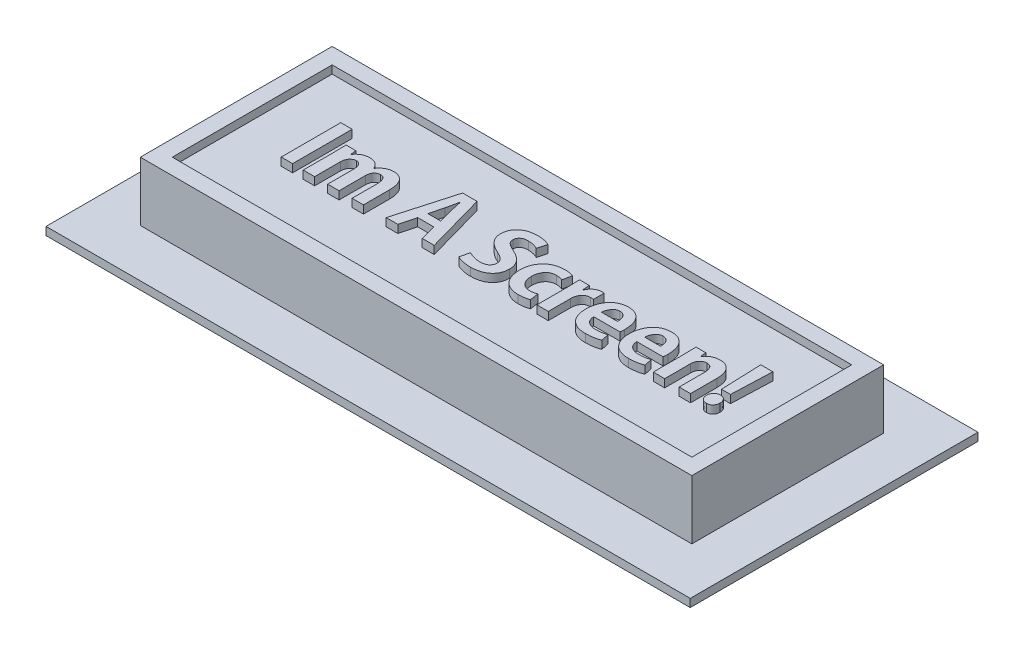
from build123d import *

# Parameters (mm, degrees)
SKETCH1_W           = 80.6
SKETCH1_H           = 36
BOSS_EXTRUDE1_DEPTH = 1
SKETCH2_W           = 69
SKETCH2_H           = 24
BOSS_EXTRUDE2_DEPTH = 7.4
SKETCH3_W           = 65
SKETCH3_H           = 20
CUT_EXTRUDE1_DEPTH  = 1
SKETCH4_W           = 1.427203244
SKETCH4_H           = 7.450666667
BOSS_EXTRUDE3_DEPTH = 1


with BuildPart() as part:
    # Sketch1 → Boss-Extrude1 (new body)
    with BuildSketch(Plane(origin=(0, 0, 0), x_dir=(1, 0, 0), z_dir=(0, 1, 0))):
        Rectangle(SKETCH1_W, SKETCH1_H)
    extrude(amount=-BOSS_EXTRUDE1_DEPTH)

    # Sketch2 → Boss-Extrude2 (add)
    with BuildSketch(Plane(origin=(0, 0, 0), x_dir=(1, 0, 0), z_dir=(0, 1, 0))):
        Rectangle(SKETCH2_W, SKETCH2_H)
    extrude(amount=BOSS_EXTRUDE2_DEPTH)

    # Sketch3 → Cut-Extrude1 (cut)
    with BuildSketch(Plane(origin=(0, 7.4, 0), x_dir=(1, 0, 0), z_dir=(0, 1, 0))):
        Rectangle(SKETCH3_W, SKETCH3_H)
    extrude(amount=-CUT_EXTRUDE1_DEPTH, mode=Mode.SUBTRACT)

    # Sketch4 → Boss-Extrude3 (add)
    # profile 1 of 11: a face of its own
    with BuildSketch(Plane(origin=(0, 6.4, 0), x_dir=(1, 0, 0), z_dir=(0, 1, 0))):
        with Locations((-24.986860891, 0.553226303)):
            Rectangle(SKETCH4_W, SKETCH4_H)
    # profile 2 of 11: a face of its own
    with BuildSketch(Plane(origin=(0, 6.4, 0), x_dir=(1, 0, 0), z_dir=(0, 1, 0))):
        with BuildLine():
            add(Edge.make_bspline(
                [(-18.68550928, 1.403628233), (-18.715742013, 1.470543978), (-18.775006998, 1.601718382), (-18.897423981, 1.778557798), (-19.042784468, 1.933158656), (-19.213006744, 2.062914701), (-19.403719743, 2.167387149), (-19.613330074, 2.243758188), (-19.841314104, 2.289041839), (-19.998939378, 2.295813045), (-20.080151408, 2.299301719)],
                knots=[0, 0, 0, 0, 0.997036998, 1.954483718, 2.909576397, 3.872577742, 4.853047321, 5.856395523, 6.895567533, 8, 8, 8, 8], degree=3))
            add(Edge.make_bspline(
                [(-20.080151408, 2.299301719), (-20.175931654, 2.294220507), (-20.359102622, 2.284503153), (-20.619315498, 2.232315153), (-20.851603177, 2.150182601), (-21.053254632, 2.035706175), (-21.227203121, 1.904301797), (-21.380552701, 1.767668543), (-21.511801742, 1.625084752), (-21.581599353, 1.52106243), (-21.615517201, 1.470513231)],
                knots=[0, 0, 0, 0, 1.262432143, 2.414286113, 3.483755676, 4.494660452, 5.455867319, 6.351457605, 7.198897928, 8, 8, 8, 8], degree=3))
            Line((-21.615517201, 1.470513231), (-21.643765368, 1.47114426))
            Line((-21.643765368, 1.47114426), (-21.712664173, 2.18488512))
            Line((-21.712664173, 2.18488512), (-22.952324115, 2.18488512))
            add(Edge.make_bspline(
                [(-22.952324115, 2.18488512), (-22.947032632, 2.064769798), (-22.936050982, 1.815489142), (-22.925072024, 1.426551849), (-22.91841677, 1.008377938), (-22.916091259, 0.719455033), (-22.914888984, 0.570083704)],
                knots=[0, 0, 0, 0, 0.893157475, 1.853609332, 2.890329491, 4, 4, 4, 4], degree=3))
            Line((-22.914888984, 0.570083704), (-22.913485629, -3.206701158))
            Line((-22.913485629, -3.206701158), (-21.486282386, -3.206701158))
            Line((-21.486282386, -3.206701158), (-21.486282386, 0.046022042))
            add(Edge.make_bspline(
                [(-21.486282386, 0.046022042), (-21.484049537, 0.089652467), (-21.479693459, 0.174771326), (-21.463671336, 0.298581361), (-21.442811317, 0.415193188), (-21.409531418, 0.522429336), (-21.370442911, 0.621275502), (-21.324123876, 0.712075144), (-21.269163279, 0.794355379), (-21.186034128, 0.888788848), (-21.075249184, 0.988412983), (-20.931056727, 1.07609466), (-20.780021693, 1.132559175), (-20.675755076, 1.138730846), (-20.623780468, 1.141807288)],
                knots=[0, 0, 0, 0, 1.015991475, 1.982103866, 2.902933749, 3.767943163, 4.589249783, 5.373677027, 6.135072995, 6.884212924, 8.29641728, 9.581790074, 10.794575681, 12, 12, 12, 12], degree=3))
            add(Edge.make_bspline(
                [(-20.623780468, 1.141807288), (-20.589948751, 1.1404445), (-20.524584699, 1.137811546), (-20.431203097, 1.117995349), (-20.344370253, 1.092861204), (-20.266829484, 1.053443895), (-20.194788562, 1.007328009), (-20.132224744, 0.948664177), (-20.074339108, 0.882407347), (-20.011753165, 0.776883203), (-19.946454781, 0.629680716), (-19.891976261, 0.433849413), (-19.861354227, 0.217077775), (-19.859283466, 0.065887809), (-19.85820466, -0.012877691)],
                knots=[0, 0, 0, 0, 0.778438463, 1.503970174, 2.193072329, 2.853909163, 3.500059889, 4.156658281, 4.822318485, 5.519726913, 6.972953294, 8.519672451, 10.186852288, 12, 12, 12, 12], degree=3))
            Line((-19.85820466, -0.012877691), (-19.856801306, -3.206701158))
            Line((-19.856801306, -3.206701158), (-18.429599434, -3.206701158))
            Line((-18.429599434, -3.206701158), (-18.429599434, 0.075150906))
            add(Edge.make_bspline(
                [(-18.429599434, 0.075150906), (-18.42795186, 0.120310165), (-18.424755671, 0.207916246), (-18.408739731, 0.334247711), (-18.386860991, 0.451847584), (-18.356322262, 0.559586044), (-18.317754996, 0.657645358), (-18.273920404, 0.746802496), (-18.219273905, 0.82479038), (-18.140467306, 0.914631663), (-18.031174132, 1.005588094), (-17.890586097, 1.087094354), (-17.740515448, 1.134332697), (-17.638114379, 1.139310847), (-17.586762312, 1.141807288)],
                knots=[0, 0, 0, 0, 1.068514525, 2.072850033, 3.009155609, 3.896203593, 4.716938048, 5.499641549, 6.240135765, 6.9622584, 8.322368171, 9.582260067, 10.787552263, 12, 12, 12, 12], degree=3))
            add(Edge.make_bspline(
                [(-17.586762312, 1.141807288), (-17.552493364, 1.140344616), (-17.485800513, 1.137498023), (-17.390042514, 1.11879991), (-17.301924417, 1.090440508), (-17.220324194, 1.053181744), (-17.148488733, 1.001154273), (-17.083367757, 0.940285247), (-17.024772886, 0.869534619), (-16.958859065, 0.756877998), (-16.890871191, 0.594404651), (-16.836268015, 0.373234693), (-16.80397803, 0.122003873), (-16.80237015, -0.055382216), (-16.801520337, -0.149136137)],
                knots=[0, 0, 0, 0, 0.723474212, 1.407996489, 2.052123571, 2.675738152, 3.292971063, 3.915565833, 4.554894172, 5.224690713, 6.664493501, 8.256831909, 10.021622282, 12, 12, 12, 12], degree=3))
            Line((-16.801520337, -0.149136137), (-16.800118354, -3.206701158))
            Line((-16.800118354, -3.206701158), (-15.372916483, -3.206701158))
            Line((-15.372916483, -3.206701158), (-15.372916483, 0.075150906))
            add(Edge.make_bspline(
                [(-15.372916483, 0.075150906), (-15.37616057, 0.168539998), (-15.382442786, 0.349389176), (-15.407379017, 0.610941515), (-15.446382022, 0.85315017), (-15.498603907, 1.076371239), (-15.568455007, 1.279333662), (-15.648284358, 1.46474208), (-15.746110714, 1.629066646), (-15.857679834, 1.773294441), (-15.980692825, 1.89798056), (-16.110517336, 2.00808759), (-16.250141919, 2.099138002), (-16.396991491, 2.174230801), (-16.551920794, 2.232561036), (-16.714960255, 2.273196961), (-16.886569928, 2.295643875), (-17.003268571, 2.298066088), (-17.06279942, 2.299301719)],
                knots=[0, 0, 0, 0, 1.420634134, 2.75107627, 3.991776804, 5.148758875, 6.231718827, 7.251719496, 8.212661777, 9.131207487, 10.017311253, 10.871462022, 11.714652689, 12.545702641, 13.374829041, 14.22612649, 15.095103491, 16, 16, 16, 16], degree=3))
            add(Edge.make_bspline(
                [(-17.06279942, 2.299301719), (-17.137426994, 2.298096698), (-17.285828755, 2.295700436), (-17.504522393, 2.255363111), (-17.718068185, 2.192257272), (-17.9253863, 2.09999594), (-18.127599974, 1.979001313), (-18.317916634, 1.819343122), (-18.502036132, 1.627690645), (-18.610615438, 1.479853124), (-18.666996799, 1.403086371)],
                knots=[0, 0, 0, 0, 0.932112966, 1.85356694, 2.770748812, 3.712089394, 4.684367622, 5.707962557, 6.809826692, 8, 8, 8, 8], degree=3))
            Line((-18.666996799, 1.403086371), (-18.68550928, 1.403628233))
        make_face()
    # profile 3 of 11: a face of its own
    with BuildSketch(Plane(origin=(0, 6.4, 0), x_dir=(1, 0, 0), z_dir=(0, 1, 0))):
        Polygon((-10.457016606, 4.278559636), (-12.573714091, -3.165307003), (-11.117270867, -3.165307003), (-10.602660928, -1.19425384), (-8.602478901, -1.19425384), (-8.068449719, -3.165307003), (-6.563458387, -3.165307003), (-8.651027008, 4.278559636), align=None)
        with BuildLine():
            add(Edge.make_bspline(
                [(-9.952116288, 1.595029044), (-9.924104669, 1.714046874), (-9.865351426, 1.963681978), (-9.782867332, 2.347764191), (-9.700448682, 2.736779984), (-9.648451785, 2.995067485), (-9.623369191, 3.11966185)],
                knots=[0, 0, 0, 0, 0.94066455, 1.973005993, 3.022205752, 4, 4, 4, 4], degree=3))
            Line((-9.623369191, 3.11966185), (-9.592860293, 3.121063833))
            add(Edge.make_bspline(
                [(-9.592860293, 3.121063833), (-9.566949881, 2.998390657), (-9.513046305, 2.743183493), (-9.431589446, 2.355045141), (-9.345293022, 1.965251047), (-9.283778659, 1.708766255), (-9.253926187, 1.584296057)],
                knots=[0, 0, 0, 0, 0.95601635, 1.988879968, 3.024018124, 4, 4, 4, 4], degree=3))
            Line((-9.253926187, 1.584296057), (-8.806380952, -0.126660517))
            Line((-8.806380952, -0.126660517), (-10.398758877, -0.126660517))
            Line((-10.398758877, -0.126660517), (-9.952116288, 1.595029044))
        make_face(mode=Mode.SUBTRACT)
    # profile 4 of 11: a face of its own
    with BuildSketch(Plane(origin=(0, 6.4, 0), x_dir=(1, 0, 0), z_dir=(0, 1, 0))):
        with BuildLine():
            add(Edge.make_bspline(
                [(-3.771451103, -2.860599382), (-3.722282859, -2.887805448), (-3.617362523, -2.945860595), (-3.438395032, -3.014616115), (-3.234557906, -3.083112804), (-3.005110188, -3.14115868), (-2.758911347, -3.1933582), (-2.500402688, -3.230936526), (-2.233560003, -3.25534473), (-2.052415796, -3.25976747), (-1.960587489, -3.262009511)],
                knots=[0, 0, 0, 0, 0.719594672, 1.535546325, 2.452393094, 3.475924305, 4.567249392, 5.677640584, 6.822715122, 8, 8, 8, 8], degree=3))
            add(Edge.make_bspline(
                [(-1.960587489, -3.262009511), (-1.85606796, -3.259382285), (-1.652613935, -3.25426822), (-1.357601219, -3.22050358), (-1.08050369, -3.173108465), (-0.822979042, -3.103293938), (-0.582641462, -3.019033348), (-0.362198874, -2.912698596), (-0.160030514, -2.788773028), (0.023065302, -2.647191351), (0.184096198, -2.488604639), (0.328200766, -2.320775478), (0.445680532, -2.13706451), (0.54598066, -1.944132128), (0.620854192, -1.73686708), (0.678375082, -1.518562006), (0.709775646, -1.28692276), (0.715372252, -1.128782748), (0.718225473, -1.048160938)],
                knots=[0, 0, 0, 0, 1.280827998, 2.493214574, 3.635842522, 4.723067123, 5.759595453, 6.75296466, 7.716578851, 8.661346905, 9.582605015, 10.482742654, 11.366187061, 12.249109382, 13.142470757, 14.061151216, 15.011549973, 16, 16, 16, 16], degree=3))
            add(Edge.make_bspline(
                [(0.718225473, -1.048160938), (0.717222288, -0.987721786), (0.715242252, -0.868429981), (0.697271514, -0.692541046), (0.663793263, -0.523434425), (0.621679095, -0.359051699), (0.561383798, -0.202469756), (0.491522024, -0.050460138), (0.406341386, 0.09418435), (0.309310931, 0.234202409), (0.197225206, 0.367952769), (0.071685862, 0.49780227), (-0.068787155, 0.622622725), (-0.224696871, 0.741719995), (-0.39295259, 0.85909217), (-0.577348695, 0.969429047), (-0.776191881, 1.074785072), (-0.914738592, 1.140469789), (-0.98570747, 1.174115992)],
                knots=[0, 0, 0, 0, 0.971604692, 1.917705205, 2.837533086, 3.741450306, 4.641944002, 5.53106885, 6.428441787, 7.336893241, 8.26704506, 9.230684205, 10.238479509, 11.285007773, 12.38342881, 13.535071349, 14.737370079, 16, 16, 16, 16], degree=3))
            add(Edge.make_bspline(
                [(-0.98570747, 1.174115992), (-1.039655802, 1.198716631), (-1.144289354, 1.246429918), (-1.294346712, 1.319143639), (-1.432446146, 1.390983512), (-1.558912636, 1.461239334), (-1.674823156, 1.529569182), (-1.778008079, 1.598794461), (-1.871317323, 1.663997439), (-1.952657836, 1.729511213), (-2.024201862, 1.795659902), (-2.085078725, 1.866284437), (-2.13623445, 1.941800965), (-2.178186141, 2.020765946), (-2.209709373, 2.104463415), (-2.231657424, 2.191644152), (-2.247000911, 2.283313189), (-2.247100836, 2.346061286), (-2.247151644, 2.377966389)],
                knots=[0, 0, 0, 0, 1.534293153, 2.975783242, 4.314400128, 5.561899513, 6.719353789, 7.794748337, 8.776507069, 9.664015056, 10.495494951, 11.294559956, 12.0708857, 12.851360931, 13.602992373, 14.37884518, 15.175702311, 16, 16, 16, 16], degree=3))
            add(Edge.make_bspline(
                [(-2.247151644, 2.377966389), (-2.244371727, 2.431248051), (-2.238866121, 2.536771979), (-2.188419226, 2.689562009), (-2.104924038, 2.830983165), (-2.009119935, 2.936244723), (-1.917253666, 3.012590038), (-1.836539195, 3.062582467), (-1.747577757, 3.107083825), (-1.648371721, 3.140822079), (-1.541343222, 3.171348678), (-1.424607179, 3.191782322), (-1.298722162, 3.20391375), (-1.211893355, 3.207636167), (-1.166917157, 3.20956433)],
                knots=[0, 0, 0, 0, 1.252807395, 2.481175558, 3.747276352, 5.098962457, 5.812468956, 6.556386487, 7.331171674, 8.151379655, 9.021437812, 9.952148669, 10.939239512, 12, 12, 12, 12], degree=3))
            add(Edge.make_bspline(
                [(-1.166917157, 3.20956433), (-1.093823556, 3.207144693), (-0.952496488, 3.202466305), (-0.748227309, 3.181716202), (-0.559480084, 3.148240069), (-0.386560039, 3.103216199), (-0.230582222, 3.050256344), (-0.089860627, 2.999407682), (0.033657585, 2.946096116), (0.108327146, 2.906592077), (0.143692436, 2.887882019)],
                knots=[0, 0, 0, 0, 1.287765497, 2.48990501, 3.61253477, 4.660633034, 5.633348447, 6.512647364, 7.29555421, 8, 8, 8, 8], degree=3))
            Line((0.143692436, 2.887882019), (0.441868904, 4.039096336))
            add(Edge.make_bspline(
                [(0.441868904, 4.039096336), (0.395556959, 4.060287288), (0.298959299, 4.104487468), (0.143679291, 4.16640754), (-0.030709131, 4.216994863), (-0.220014908, 4.26948047), (-0.427018144, 4.31065447), (-0.650008684, 4.343863331), (-0.889472918, 4.360714232), (-1.054051658, 4.364901823), (-1.138822632, 4.367058762)],
                knots=[0, 0, 0, 0, 0.751083297, 1.566612858, 2.462144976, 3.426904781, 4.462872615, 5.572206229, 6.749495582, 8, 8, 8, 8], degree=3))
            add(Edge.make_bspline(
                [(-1.138822632, 4.367058762), (-1.23629599, 4.363645993), (-1.426089405, 4.357000884), (-1.701782775, 4.326225596), (-1.960688831, 4.277314782), (-2.20262009, 4.20986657), (-2.428826865, 4.126025665), (-2.637920631, 4.023118581), (-2.830354009, 3.901977937), (-3.004171215, 3.762448368), (-3.160473433, 3.609892738), (-3.295660074, 3.444378135), (-3.412274493, 3.269519322), (-3.506941852, 3.08277457), (-3.579812921, 2.885004241), (-3.633167352, 2.677003069), (-3.668040913, 2.458247917), (-3.67315173, 2.308331878), (-3.675758242, 2.231874859)],
                knots=[0, 0, 0, 0, 1.256955866, 2.447457956, 3.572082846, 4.649959342, 5.681406033, 6.67750641, 7.648772353, 8.6065338, 9.545567091, 10.459092244, 11.356420819, 12.24994494, 13.151405518, 14.067877277, 15.01461949, 16, 16, 16, 16], degree=3))
            add(Edge.make_bspline(
                [(-3.675758242, 2.231874859), (-3.673522001, 2.171857755), (-3.6691024, 2.053242783), (-3.644408676, 1.878470584), (-3.607179779, 1.70941945), (-3.553397528, 1.546600513), (-3.48360207, 1.390828755), (-3.40273037, 1.239385243), (-3.304658205, 1.095397424), (-3.191810854, 0.95814642), (-3.067007782, 0.826661192), (-2.930790557, 0.70063482), (-2.783533162, 0.580004846), (-2.623895631, 0.46516043), (-2.454363397, 0.353105007), (-2.270893081, 0.250818214), (-2.078379042, 0.149399324), (-1.943629211, 0.089377743), (-1.874899187, 0.058763348)],
                knots=[0, 0, 0, 0, 0.960729928, 1.898741275, 2.820565259, 3.728266954, 4.637606962, 5.549753057, 6.472673147, 7.420779733, 8.390934511, 9.372027768, 10.389211705, 11.435574366, 12.518575566, 13.639649148, 14.796087777, 16, 16, 16, 16], degree=3))
            add(Edge.make_bspline(
                [(-1.874899187, 0.058763348), (-1.779632101, 0.015661072), (-1.60029954, -0.065475464), (-1.356887305, -0.201007172), (-1.152683584, -0.336895389), (-0.988662531, -0.479305943), (-0.858952119, -0.628966487), (-0.771383209, -0.795337274), (-0.715754283, -0.975315563), (-0.711269775, -1.100654765), (-0.708976399, -1.164753217)],
                knots=[0, 0, 0, 0, 1.393665495, 2.6234622, 3.710952145, 4.657720235, 5.513058752, 6.334242817, 7.148131986, 8, 8, 8, 8], degree=3))
            add(Edge.make_bspline(
                [(-0.708976399, -1.164753217), (-0.709636842, -1.199454727), (-0.710927855, -1.267288038), (-0.725375188, -1.366185425), (-0.748942046, -1.459629757), (-0.783540964, -1.547264923), (-0.825223607, -1.630774251), (-0.877787187, -1.708514362), (-0.94008988, -1.780567165), (-1.011777267, -1.846470324), (-1.092395917, -1.905675814), (-1.181754822, -1.95806395), (-1.280082102, -2.002848995), (-1.387396644, -2.039372178), (-1.503664946, -2.067047737), (-1.628442726, -2.088218445), (-1.762753761, -2.10054525), (-1.855208925, -2.103162416), (-1.902993713, -2.10451508)],
                knots=[0, 0, 0, 0, 0.969766496, 1.895666023, 2.788091005, 3.658633537, 4.525326931, 5.393305268, 6.275294433, 7.18343149, 8.110533905, 9.067217099, 10.075045017, 11.126827756, 12.232027601, 13.413846859, 14.663365337, 16, 16, 16, 16], degree=3))
            add(Edge.make_bspline(
                [(-1.902993713, -2.10451508), (-1.977958462, -2.102092257), (-2.126792711, -2.09728201), (-2.347999356, -2.075026536), (-2.564708483, -2.036691025), (-2.775287138, -1.985110449), (-2.975697763, -1.922083227), (-3.163280602, -1.852373414), (-3.335352836, -1.77427228), (-3.441575771, -1.713839997), (-3.493143829, -1.68450193)],
                knots=[0, 0, 0, 0, 1.082450425, 2.149086012, 3.20582521, 4.256603573, 5.276294291, 6.236645749, 7.143944243, 8, 8, 8, 8], degree=3))
            Line((-3.493143829, -1.68450193), (-3.771451103, -2.860599382))
        make_face()
    # profile 5 of 11: a face of its own
    with BuildSketch(Plane(origin=(0, 6.4, 0), x_dir=(1, 0, 0), z_dir=(0, 1, 0))):
        with BuildLine():
            add(Edge.make_bspline(
                [(5.382372067, 2.175683065), (5.350009647, 2.188124912), (5.280879448, 2.21470226), (5.168902518, 2.251132225), (5.042007624, 2.284046219), (4.850808852, 2.328746089), (4.587046542, 2.370044636), (4.368826539, 2.377104087), (4.255326174, 2.380775842)],
                knots=[0, 0, 0, 0, 0.541847231, 1.15745385, 1.839115937, 2.590051948, 4.226421316, 6, 6, 6, 6], degree=3))
            add(Edge.make_bspline(
                [(4.255326174, 2.380775842), (4.146541026, 2.376635202), (3.93420519, 2.36855316), (3.626311622, 2.324208954), (3.337500424, 2.257047553), (3.067392446, 2.16589883), (2.816483792, 2.049474336), (2.58559993, 1.907384776), (2.37284885, 1.74273018), (2.183136715, 1.55179467), (2.011372101, 1.345026212), (1.864134786, 1.12122483), (1.735983875, 0.886162339), (1.633725944, 0.635088023), (1.552253265, 0.370952111), (1.493151703, 0.093190692), (1.457947043, -0.198349317), (1.451817846, -0.397208339), (1.448683124, -0.498912974)],
                knots=[0, 0, 0, 0, 1.154617847, 2.253678444, 3.29503799, 4.29757116, 5.27348448, 6.223708663, 7.168982913, 8.121179864, 9.074245094, 10.016903677, 10.959562261, 11.910942048, 12.888561654, 13.88945568, 14.920581334, 16, 16, 16, 16], degree=3))
            add(Edge.make_bspline(
                [(1.448683124, -0.498912974), (1.451770124, -0.604367678), (1.457796644, -0.810238985), (1.493267726, -1.109475691), (1.548916261, -1.390612173), (1.626332139, -1.653542979), (1.724504228, -1.898929253), (1.843829604, -2.126370911), (1.985828536, -2.334642256), (2.147486665, -2.524292374), (2.326790091, -2.69465822), (2.524314637, -2.841936337), (2.736831789, -2.966976941), (2.965025917, -3.070682603), (3.209790544, -3.150144426), (3.469656027, -3.209334701), (3.745883842, -3.244368369), (3.934949788, -3.250456728), (4.0319747, -3.253581153)],
                knots=[0, 0, 0, 0, 1.185825819, 2.314998766, 3.383718313, 4.404951788, 5.392442684, 6.351016225, 7.287101152, 8.220828758, 9.148225935, 10.062254741, 10.985112179, 11.915866123, 12.874902268, 13.873739595, 14.908845112, 16, 16, 16, 16], degree=3))
            add(Edge.make_bspline(
                [(4.0319747, -3.253581153), (4.102703071, -3.252348265), (4.240552643, -3.249945367), (4.441195663, -3.235803151), (4.630623893, -3.213503539), (4.807305724, -3.182939261), (4.968214113, -3.146373849), (5.111650076, -3.109164613), (5.234779447, -3.068010957), (5.308600918, -3.035406094), (5.342584293, -3.020396596)],
                knots=[0, 0, 0, 0, 1.266754215, 2.468903584, 3.600631184, 4.681535172, 5.678465714, 6.555210452, 7.334897762, 8, 8, 8, 8], degree=3))
            Line((5.342584293, -3.020396596), (5.188179637, -1.937923326))
            add(Edge.make_bspline(
                [(5.188179637, -1.937923326), (5.127888133, -1.964319845), (5.001938823, -2.019462329), (4.792095161, -2.069512161), (4.560345681, -2.104136082), (4.397819537, -2.109921355), (4.312919951, -2.112943437)],
                knots=[0, 0, 0, 0, 0.87676423, 1.831565681, 2.867264228, 4, 4, 4, 4], degree=3))
            add(Edge.make_bspline(
                [(4.312919951, -2.112943437), (4.261329189, -2.111125325), (4.160530126, -2.107573062), (4.013444901, -2.085613406), (3.872959089, -2.053123922), (3.741165611, -2.002363267), (3.614219686, -1.942758374), (3.496559975, -1.866142801), (3.386312861, -1.776800508), (3.283499353, -1.675797275), (3.190238908, -1.561610547), (3.109601952, -1.434682081), (3.037682566, -1.297827624), (2.982706972, -1.147630005), (2.937633264, -0.986997837), (2.904037291, -0.815129837), (2.882724501, -0.631946078), (2.879133655, -0.50599583), (2.877289722, -0.441319198)],
                knots=[0, 0, 0, 0, 0.998859532, 1.951591722, 2.875231318, 3.78469887, 4.680917394, 5.586353418, 6.495459316, 7.425131778, 8.372498858, 9.343309935, 10.332783696, 11.360046324, 12.433641722, 13.561024455, 14.747563201, 16, 16, 16, 16], degree=3))
            add(Edge.make_bspline(
                [(2.877289722, -0.441319198), (2.878771355, -0.381801375), (2.881671647, -0.265295407), (2.900509311, -0.094451195), (2.929270014, 0.068180052), (2.970628417, 0.222591773), (3.021813744, 0.369361237), (3.087386371, 0.506817149), (3.161436113, 0.637568908), (3.248716182, 0.757550268), (3.345061522, 0.86832166), (3.453910362, 0.96365143), (3.572028625, 1.046238175), (3.699221975, 1.115586887), (3.837796795, 1.166998003), (3.984388206, 1.206665986), (4.141173519, 1.2322422), (4.249144233, 1.237462251), (4.304491593, 1.240138126)],
                knots=[0, 0, 0, 0, 1.152800695, 2.256604074, 3.325842897, 4.34888118, 5.35009528, 6.332019554, 7.295036531, 8.256642933, 9.201201668, 10.132957584, 11.051374066, 11.988807583, 12.930444073, 13.907328497, 14.927266108, 16, 16, 16, 16], degree=3))
            add(Edge.make_bspline(
                [(4.304491593, 1.240138126), (4.35133733, 1.238153054), (4.441855939, 1.23431736), (4.572590215, 1.222985957), (4.693120354, 1.207995072), (4.803721458, 1.188088595), (4.904349021, 1.165012321), (4.995210086, 1.136318574), (5.076759863, 1.105414633), (5.125568569, 1.078652683), (5.14873207, 1.06595207)],
                knots=[0, 0, 0, 0, 1.29360923, 2.499602188, 3.619770261, 4.643630639, 5.599445193, 6.465756666, 7.271883015, 8, 8, 8, 8], degree=3))
            Line((5.14873207, 1.06595207), (5.382372067, 2.175683065))
        make_face()
    # profile 6 of 11: a face of its own
    with BuildSketch(Plane(origin=(0, 6.4, 0), x_dir=(1, 0, 0), z_dir=(0, 1, 0))):
        with BuildLine():
            Line((7.548791923, 1.266912976), (7.490929273, 2.186923619))
            Line((7.490929273, 2.186923619), (6.265981918, 2.186923619))
            add(Edge.make_bspline(
                [(6.265981918, 2.186923619), (6.270642549, 2.064716978), (6.280302257, 1.811429272), (6.290267381, 1.488791784), (6.298734602, 1.214889362), (6.300254262, 0.995242611), (6.304273641, 0.763947673), (6.303707612, 0.606140392), (6.303417049, 0.525132463)],
                knots=[0, 0, 0, 0, 1.324207679, 2.744576904, 3.495229973, 4.291304775, 5.122867722, 6, 6, 6, 6], degree=3))
            Line((6.303417049, 0.525132463), (6.304820404, -3.192313689))
            Line((6.304820404, -3.192313689), (7.732023647, -3.192313689))
            Line((7.732023647, -3.192313689), (7.732023647, -0.395942699))
            add(Edge.make_bspline(
                [(7.732023647, -0.395942699), (7.733601296, -0.340319586), (7.736661567, -0.232423676), (7.753649227, -0.076213105), (7.780018377, 0.068960217), (7.816096063, 0.203181269), (7.863316247, 0.325878994), (7.916576698, 0.439461022), (7.984323838, 0.539453848), (8.058251805, 0.630266705), (8.141513952, 0.708092098), (8.229476518, 0.77706132), (8.323790405, 0.833939598), (8.422884349, 0.882994675), (8.528706079, 0.919318276), (8.639981656, 0.943911646), (8.756506056, 0.960506437), (8.836077949, 0.961495316), (8.876875542, 0.962002328)],
                knots=[0, 0, 0, 0, 1.328993375, 2.577938255, 3.749595128, 4.851401761, 5.892294362, 6.887899519, 7.84040204, 8.769965346, 9.679936652, 10.557066843, 11.435764995, 12.306307666, 13.19428498, 14.100673707, 15.026189549, 16, 16, 16, 16], degree=3))
            add(Edge.make_bspline(
                [(8.876875542, 0.962002328), (8.94349083, 0.961233649), (9.067268928, 0.959805364), (9.189753232, 0.942089354), (9.246318546, 0.933907803)],
                knots=[0, 0, 0, 0, 1.076366321, 2, 2, 2, 2], degree=3))
            Line((9.246318546, 0.933907803), (9.2467246, 2.272285431))
            add(Edge.make_bspline(
                [(9.2467246, 2.272285431), (9.198005174, 2.280690514), (9.091936576, 2.298989486), (8.984259698, 2.299192145), (8.926040961, 2.299301719)],
                knots=[0, 0, 0, 0, 0.918639949, 2, 2, 2, 2], degree=3))
            add(Edge.make_bspline(
                [(8.926040961, 2.299301719), (8.860688979, 2.295788158), (8.72921732, 2.288719763), (8.533846855, 2.239007728), (8.342579029, 2.155198449), (8.154992817, 2.042402247), (7.978756961, 1.8968055), (7.824617664, 1.715773059), (7.689348792, 1.505476471), (7.622057096, 1.348053094), (7.587336843, 1.266827924)],
                knots=[0, 0, 0, 0, 0.873024494, 1.756304479, 2.675727742, 3.655517484, 4.673026258, 5.715548879, 6.821300036, 8, 8, 8, 8], degree=3))
            Line((7.587336843, 1.266827924), (7.548791923, 1.266912976))
        make_face()
    # profile 7 of 11: a face of its own
    with BuildSketch(Plane(origin=(0, 6.4, 0), x_dir=(1, 0, 0), z_dir=(0, 1, 0))):
        with BuildLine():
            add(Edge.make_bspline(
                [(14.432329174, -0.9245464), (14.438405913, -0.883856406), (14.451152409, -0.798505562), (14.46328694, -0.663945946), (14.47037544, -0.518190747), (14.470454619, -0.417447558), (14.470495476, -0.36546398)],
                knots=[0, 0, 0, 0, 0.879814102, 1.845487553, 2.888269607, 4, 4, 4, 4], degree=3))
            add(Edge.make_bspline(
                [(14.470495476, -0.36546398), (14.46816519, -0.259099072), (14.463639096, -0.052507535), (14.43368868, 0.247401503), (14.386966814, 0.527459517), (14.320639362, 0.78714654), (14.238312252, 1.027370762), (14.137502587, 1.247701079), (14.01717753, 1.447017895), (13.88095764, 1.626453165), (13.727871326, 1.784335801), (13.562227313, 1.923621831), (13.380604308, 2.038018053), (13.18830861, 2.136131381), (12.980283994, 2.207541266), (12.760028076, 2.262056261), (12.52578633, 2.292361255), (12.365359878, 2.29695369), (12.283336702, 2.299301719)],
                knots=[0, 0, 0, 0, 1.306657607, 2.537908493, 3.699270234, 4.791739878, 5.826909547, 6.815290999, 7.762398175, 8.68170366, 9.57675071, 10.459137333, 11.333612719, 12.208315133, 13.105301175, 14.028952094, 14.992238463, 16, 16, 16, 16], degree=3))
            add(Edge.make_bspline(
                [(12.283336702, 2.299301719), (12.185772237, 2.29410807), (11.995757772, 2.283993031), (11.719829421, 2.238603111), (11.461854746, 2.168482689), (11.220903831, 2.074590985), (10.999089583, 1.954158342), (10.794702817, 1.810121209), (10.609789212, 1.639710998), (10.4434884, 1.446945245), (10.294913625, 1.237003622), (10.167584924, 1.012166979), (10.05641265, 0.777163191), (9.969054776, 0.52858699), (9.898100021, 0.269601557), (9.84811663, -0.001053005), (9.816325184, -0.283237593), (9.811879607, -0.475414327), (9.809613773, -0.573363465)],
                knots=[0, 0, 0, 0, 1.102218766, 2.14665769, 3.149339139, 4.115122672, 5.058741015, 5.991431174, 6.93040496, 7.889527187, 8.860316271, 9.828598601, 10.80279168, 11.790822775, 12.798603709, 13.831085196, 14.894541863, 16, 16, 16, 16], degree=3))
            add(Edge.make_bspline(
                [(9.809613773, -0.573363465), (9.81155863, -0.675086298), (9.81534319, -0.873032118), (9.850874263, -1.161221784), (9.902734815, -1.433209511), (9.977924873, -1.688249056), (10.070791448, -1.927526677), (10.189331123, -2.147705006), (10.325428521, -2.352927719), (10.483240445, -2.540040383), (10.660484649, -2.708540877), (10.859022197, -2.853398886), (11.074921123, -2.977984211), (11.310425727, -3.079092425), (11.56401175, -3.159331505), (11.837036174, -3.215894821), (12.128268967, -3.253384828), (12.329103886, -3.259083235), (12.432237685, -3.262009511)],
                knots=[0, 0, 0, 0, 1.145056205, 2.228202694, 3.265464393, 4.259985655, 5.218630789, 6.1504322, 7.070355583, 7.987236137, 8.901139799, 9.817656355, 10.748382851, 11.702521477, 12.69814653, 13.738580065, 14.838703788, 16, 16, 16, 16], degree=3))
            add(Edge.make_bspline(
                [(12.432237685, -3.262009511), (12.517482792, -3.26087153), (12.685303635, -3.258631203), (12.933209513, -3.242670138), (13.172783083, -3.217985878), (13.40279919, -3.182538083), (13.622072296, -3.139999799), (13.827197404, -3.086457603), (14.019038555, -3.026744937), (14.139271375, -2.978117995), (14.197978583, -2.954374462)],
                knots=[0, 0, 0, 0, 1.134244074, 2.232970358, 3.304290349, 4.337913843, 5.328893587, 6.274899807, 7.157669119, 8, 8, 8, 8], degree=3))
            Line((14.197978583, -2.954374462), (13.995396206, -1.974819339))
            add(Edge.make_bspline(
                [(13.995396206, -1.974819339), (13.901499413, -2.007055262), (13.70569648, -2.074276815), (13.386629168, -2.136427738), (13.036079752, -2.181235002), (12.790603471, -2.189899772), (12.66261279, -2.19441756)],
                knots=[0, 0, 0, 0, 0.87704573, 1.828902987, 2.867995791, 4, 4, 4, 4], degree=3))
            add(Edge.make_bspline(
                [(12.66261279, -2.19441756), (12.612483533, -2.194193405), (12.513456948, -2.193750606), (12.367927612, -2.180802743), (12.22833791, -2.158843848), (12.095358724, -2.125504337), (11.966869211, -2.085875698), (11.845186794, -2.033294387), (11.72892387, -1.972679857), (11.619083961, -1.902756885), (11.517517845, -1.821981499), (11.428531856, -1.727872409), (11.349961778, -1.62338832), (11.286404065, -1.505792066), (11.231366319, -1.377905472), (11.192454385, -1.237353669), (11.161570708, -1.085812828), (11.152833299, -0.980417188), (11.148317891, -0.925949754)],
                knots=[0, 0, 0, 0, 1.08234867, 2.138098532, 3.15234098, 4.131067708, 5.097013137, 6.053166887, 6.989593978, 7.926621641, 8.861682363, 9.784465562, 10.716952089, 11.676682853, 12.664718862, 13.717752465, 14.820556852, 16, 16, 16, 16], degree=3))
            Line((11.148317891, -0.925949754), (14.432329174, -0.9245464))
        make_face()
        with BuildLine():
            add(Edge.make_bspline(
                [(11.148317891, 0.053144443), (11.155442495, 0.125052301), (11.169762536, 0.269582937), (11.223855714, 0.483104371), (11.309193221, 0.690878461), (11.398157996, 0.859167517), (11.4837805, 0.986264496), (11.559423613, 1.070312274), (11.643808473, 1.142437941), (11.737519234, 1.201299814), (11.838614016, 1.250134114), (11.949179576, 1.286202027), (12.068283266, 1.312040736), (12.151162029, 1.318379282), (12.193434222, 1.321612248)],
                knots=[0, 0, 0, 0, 1.434019087, 2.882295425, 4.35559367, 5.887023456, 6.655881304, 7.39355732, 8.125995891, 8.853635031, 9.585837332, 10.350577125, 11.158714241, 12, 12, 12, 12], degree=3))
            add(Edge.make_bspline(
                [(12.193434222, 1.321612248), (12.236599341, 1.318150325), (12.320152868, 1.311449176), (12.440531063, 1.289354055), (12.550970391, 1.254798003), (12.649816133, 1.205902597), (12.740239622, 1.148434565), (12.81903591, 1.077072214), (12.888876169, 0.995373117), (12.964126657, 0.870347984), (13.038166746, 0.703032758), (13.105160054, 0.49382136), (13.138675733, 0.275270329), (13.139701559, 0.127689324), (13.140219716, 0.053144443)],
                knots=[0, 0, 0, 0, 0.873766243, 1.691325154, 2.465551819, 3.201135629, 3.9116346, 4.62125276, 5.338946048, 6.073375047, 7.558144449, 9.023104326, 10.496335382, 12, 12, 12, 12], degree=3))
            Line((13.140219716, 0.053144443), (11.148317891, 0.053144443))
        make_face(mode=Mode.SUBTRACT)
    # profile 8 of 11: a face of its own
    with BuildSketch(Plane(origin=(0, 6.4, 0), x_dir=(1, 0, 0), z_dir=(0, 1, 0))):
        with BuildLine():
            add(Edge.make_bspline(
                [(19.82647798, -0.9245464), (19.832554719, -0.883856406), (19.845301215, -0.798505562), (19.857435746, -0.663945946), (19.864524246, -0.518190747), (19.864603425, -0.417447558), (19.864644282, -0.36546398)],
                knots=[0, 0, 0, 0, 0.879814102, 1.845487553, 2.888269607, 4, 4, 4, 4], degree=3))
            add(Edge.make_bspline(
                [(19.864644282, -0.36546398), (19.862313996, -0.259099072), (19.857787902, -0.052507535), (19.827837486, 0.247401503), (19.781115621, 0.527459517), (19.714788168, 0.78714654), (19.632461058, 1.027370762), (19.531651393, 1.247701079), (19.411326336, 1.447017895), (19.275106446, 1.626453165), (19.122020132, 1.784335801), (18.956376119, 1.923621831), (18.774753114, 2.038018053), (18.582457416, 2.136131381), (18.3744328, 2.207541266), (18.154176883, 2.262056261), (17.919935137, 2.292361255), (17.759508684, 2.29695369), (17.677485508, 2.299301719)],
                knots=[0, 0, 0, 0, 1.306657607, 2.537908493, 3.699270234, 4.791739878, 5.826909547, 6.815290999, 7.762398175, 8.68170366, 9.57675071, 10.459137333, 11.333612719, 12.208315133, 13.105301175, 14.028952094, 14.992238463, 16, 16, 16, 16], degree=3))
            add(Edge.make_bspline(
                [(17.677485508, 2.299301719), (17.579921043, 2.29410807), (17.389906579, 2.283993031), (17.113978227, 2.238603111), (16.856003553, 2.168482689), (16.615052637, 2.074590985), (16.39323839, 1.954158342), (16.188851624, 1.810121209), (16.003938018, 1.639710998), (15.837637206, 1.446945245), (15.689062431, 1.237003622), (15.56173373, 1.012166979), (15.450561456, 0.777163191), (15.363203582, 0.52858699), (15.292248827, 0.269601557), (15.242265436, -0.001053005), (15.21047399, -0.283237593), (15.206028413, -0.475414327), (15.203762579, -0.573363465)],
                knots=[0, 0, 0, 0, 1.102218766, 2.14665769, 3.149339139, 4.115122672, 5.058741015, 5.991431174, 6.93040496, 7.889527187, 8.860316271, 9.828598601, 10.80279168, 11.790822775, 12.798603709, 13.831085196, 14.894541863, 16, 16, 16, 16], degree=3))
            add(Edge.make_bspline(
                [(15.203762579, -0.573363465), (15.205707436, -0.675086298), (15.209491997, -0.873032118), (15.245023069, -1.161221784), (15.296883622, -1.433209511), (15.372073679, -1.688249056), (15.464940255, -1.927526677), (15.583479929, -2.147705006), (15.719577328, -2.352927719), (15.877389252, -2.540040383), (16.054633455, -2.708540877), (16.253171003, -2.853398886), (16.469069929, -2.977984211), (16.704574533, -3.079092425), (16.958160556, -3.159331505), (17.23118498, -3.215894821), (17.522417774, -3.253384828), (17.723252692, -3.259083235), (17.826386491, -3.262009511)],
                knots=[0, 0, 0, 0, 1.145056205, 2.228202694, 3.265464393, 4.259985655, 5.218630789, 6.1504322, 7.070355583, 7.987236137, 8.901139799, 9.817656355, 10.748382851, 11.702521477, 12.69814653, 13.738580065, 14.838703788, 16, 16, 16, 16], degree=3))
            add(Edge.make_bspline(
                [(17.826386491, -3.262009511), (17.911631598, -3.26087153), (18.079452441, -3.258631203), (18.327358319, -3.242670138), (18.566931889, -3.217985878), (18.796947996, -3.182538083), (19.016221102, -3.139999799), (19.22134621, -3.086457603), (19.413187361, -3.026744937), (19.533420181, -2.978117995), (19.592127389, -2.954374462)],
                knots=[0, 0, 0, 0, 1.134244074, 2.232970358, 3.304290349, 4.337913843, 5.328893587, 6.274899807, 7.157669119, 8, 8, 8, 8], degree=3))
            Line((19.592127389, -2.954374462), (19.389545013, -1.974819339))
            add(Edge.make_bspline(
                [(19.389545013, -1.974819339), (19.295648219, -2.007055262), (19.099845286, -2.074276815), (18.780777974, -2.136427738), (18.430228558, -2.181235002), (18.184752277, -2.189899772), (18.056761596, -2.19441756)],
                knots=[0, 0, 0, 0, 0.87704573, 1.828902987, 2.867995791, 4, 4, 4, 4], degree=3))
            add(Edge.make_bspline(
                [(18.056761596, -2.19441756), (18.006632339, -2.194193405), (17.907605754, -2.193750606), (17.762076418, -2.180802743), (17.622486716, -2.158843848), (17.48950753, -2.125504337), (17.361018017, -2.085875698), (17.2393356, -2.033294387), (17.123072676, -1.972679857), (17.013232767, -1.902756885), (16.911666651, -1.821981499), (16.822680662, -1.727872409), (16.744110584, -1.62338832), (16.680552871, -1.505792066), (16.625515125, -1.377905472), (16.586603191, -1.237353669), (16.555719514, -1.085812828), (16.546982105, -0.980417188), (16.542466697, -0.925949754)],
                knots=[0, 0, 0, 0, 1.08234867, 2.138098532, 3.15234098, 4.131067708, 5.097013137, 6.053166887, 6.989593978, 7.926621641, 8.861682363, 9.784465562, 10.716952089, 11.676682853, 12.664718862, 13.717752465, 14.820556852, 16, 16, 16, 16], degree=3))
            Line((16.542466697, -0.925949754), (19.82647798, -0.9245464))
        make_face()
        with BuildLine():
            add(Edge.make_bspline(
                [(16.542466697, 0.053144443), (16.549591301, 0.125052301), (16.563911342, 0.269582937), (16.61800452, 0.483104371), (16.703342027, 0.690878461), (16.792306802, 0.859167517), (16.877929307, 0.986264496), (16.95357242, 1.070312274), (17.03795728, 1.142437941), (17.13166804, 1.201299814), (17.232762822, 1.250134114), (17.343328382, 1.286202027), (17.462432072, 1.312040736), (17.545310835, 1.318379282), (17.587583028, 1.321612248)],
                knots=[0, 0, 0, 0, 1.434019087, 2.882295425, 4.35559367, 5.887023456, 6.655881304, 7.39355732, 8.125995891, 8.853635031, 9.585837332, 10.350577125, 11.158714241, 12, 12, 12, 12], degree=3))
            add(Edge.make_bspline(
                [(17.587583028, 1.321612248), (17.630748147, 1.318150325), (17.714301674, 1.311449176), (17.834679869, 1.289354055), (17.945119197, 1.254798003), (18.04396494, 1.205902597), (18.134388428, 1.148434565), (18.213184717, 1.077072214), (18.283024975, 0.995373117), (18.358275464, 0.870347984), (18.432315552, 0.703032758), (18.49930886, 0.49382136), (18.532824539, 0.275270329), (18.533850365, 0.127689324), (18.534368522, 0.053144443)],
                knots=[0, 0, 0, 0, 0.873766243, 1.691325154, 2.465551819, 3.201135629, 3.9116346, 4.62125276, 5.338946048, 6.073375047, 7.558144449, 9.023104326, 10.496335382, 12, 12, 12, 12], degree=3))
            Line((18.534368522, 0.053144443), (16.542466697, 0.053144443))
        make_face(mode=Mode.SUBTRACT)
    # profile 9 of 11: a face of its own
    with BuildSketch(Plane(origin=(0, 6.4, 0), x_dir=(1, 0, 0), z_dir=(0, 1, 0))):
        with BuildLine():
            Line((22.13228125, 1.468439065), (22.064774825, 2.185857728))
            Line((22.064774825, 2.185857728), (20.830183694, 2.185857728))
            add(Edge.make_bspline(
                [(20.830183694, 2.185857728), (20.83548006, 2.066823174), (20.846502643, 1.819093278), (20.857410016, 1.432638556), (20.864107513, 1.016338457), (20.866420797, 0.728819968), (20.867618826, 0.579916787)],
                knots=[0, 0, 0, 0, 0.890017302, 1.852267986, 2.887709342, 4, 4, 4, 4], degree=3))
            Line((20.867618826, 0.579916787), (20.86902218, -3.196991537))
            Line((20.86902218, -3.196991537), (22.296225424, -3.196991537))
            Line((22.296225424, -3.196991537), (22.296225424, 0.016893177))
            add(Edge.make_bspline(
                [(22.296225424, 0.016893177), (22.298863123, 0.066015534), (22.303958401, 0.160905824), (22.321729646, 0.297684791), (22.350238762, 0.423448051), (22.385826689, 0.538574335), (22.431439721, 0.642507461), (22.484869724, 0.736267515), (22.547554947, 0.819619904), (22.643025411, 0.910912023), (22.768287883, 1.004165277), (22.925936476, 1.086253498), (23.087337555, 1.136028155), (23.196329043, 1.139899624), (23.250034549, 1.141807288)],
                knots=[0, 0, 0, 0, 1.073396119, 2.073493126, 3.005657439, 3.884721593, 4.699227313, 5.477476558, 6.235744708, 6.965592625, 8.353334585, 9.628448595, 10.831419129, 12, 12, 12, 12], degree=3))
            add(Edge.make_bspline(
                [(23.250034549, 1.141807288), (23.287538684, 1.139575125), (23.360550427, 1.135229627), (23.46595784, 1.119369545), (23.562534721, 1.09078212), (23.650401959, 1.052785377), (23.730496043, 1.00489627), (23.800403854, 0.94504115), (23.86389162, 0.876988282), (23.934397492, 0.770001173), (24.00646176, 0.618836726), (24.066657944, 0.417521984), (24.099887322, 0.194268339), (24.1026613, 0.0387408), (24.10410811, -0.042376942)],
                knots=[0, 0, 0, 0, 0.816807223, 1.590131815, 2.311798018, 3.00031103, 3.66733495, 4.332179557, 4.995150478, 5.68419025, 7.109490456, 8.620096328, 10.237160069, 12, 12, 12, 12], degree=3))
            Line((24.10410811, -0.042376942), (24.105511464, -3.196991537))
            Line((24.105511464, -3.196991537), (25.532713336, -3.196991537))
            Line((25.532713336, -3.196991537), (25.532713336, 0.113989392))
            add(Edge.make_bspline(
                [(25.532713336, 0.113989392), (25.529629373, 0.204750948), (25.52366654, 0.380238179), (25.496559611, 0.63438952), (25.456659024, 0.87016472), (25.402361964, 1.088041923), (25.332323769, 1.287271686), (25.246795238, 1.467740537), (25.146285123, 1.630168408), (25.030886108, 1.773337764), (24.903630226, 1.899046898), (24.767506219, 2.007419278), (24.622194246, 2.098461246), (24.469132238, 2.172818517), (24.307253577, 2.231281388), (24.136645251, 2.27147624), (23.95733962, 2.29609618), (23.834949824, 2.298219762), (23.772592714, 2.299301719)],
                knots=[0, 0, 0, 0, 1.372915438, 2.654528409, 3.861684647, 4.986541305, 6.045839087, 7.049831331, 8.000787439, 8.9274714, 9.823708937, 10.700634411, 11.55326777, 12.411469168, 13.269290746, 14.150323087, 15.057597044, 16, 16, 16, 16], degree=3))
            add(Edge.make_bspline(
                [(23.772592714, 2.299301719), (23.674945508, 2.294153243), (23.486233966, 2.284203374), (23.216668094, 2.23169526), (22.97118364, 2.151356132), (22.755442777, 2.037388702), (22.566929048, 1.906465549), (22.403372369, 1.769098764), (22.264322926, 1.626030478), (22.194062873, 1.51943337), (22.159966977, 1.467703778)],
                knots=[0, 0, 0, 0, 1.239778039, 2.395976635, 3.474709784, 4.506040945, 5.480280262, 6.382742726, 7.215175167, 8, 8, 8, 8], degree=3))
            Line((22.159966977, 1.467703778), (22.13228125, 1.468439065))
        make_face()
    # profile 10 of 11: a face of its own
    with BuildSketch(Plane(origin=(0, 6.4, 0), x_dir=(1, 0, 0), z_dir=(0, 1, 0))):
        Polygon((26.803788938, 4.316470783), (26.997981368, -0.790790122), (28.124297461, -0.790790122), (28.318489891, 4.316470783), align=None)
    # profile 11 of 11: a face of its own
    with BuildSketch(Plane(origin=(0, 6.4, 0), x_dir=(1, 0, 0), z_dir=(0, 1, 0))):
        with BuildLine():
            add(Edge.make_bspline(
                [(27.561183312, -3.257033981), (27.623782331, -3.253097799), (27.743449648, -3.245573202), (27.912632983, -3.196763067), (28.05987969, -3.117249191), (28.183667351, -3.008445284), (28.282465239, -2.876588279), (28.355202983, -2.724978721), (28.399163636, -2.555011692), (28.406040018, -2.435824386), (28.409594071, -2.37422252)],
                knots=[0, 0, 0, 0, 1.094580214, 2.0924526, 3.052642815, 3.998758392, 4.952077999, 5.915476296, 6.922615544, 8, 8, 8, 8], degree=3))
            add(Edge.make_bspline(
                [(28.409594071, -2.37422252), (28.406458453, -2.310185188), (28.400442358, -2.187321136), (28.351700099, -2.013971873), (28.279285869, -1.85915282), (28.17631306, -1.72728101), (28.051014036, -1.619441036), (27.904322002, -1.540961346), (27.738857006, -1.491628844), (27.621898939, -1.484513193), (27.561139415, -1.480816624)],
                knots=[0, 0, 0, 0, 1.112338173, 2.13416723, 3.110756722, 4.068991824, 5.022504817, 5.966643353, 6.943674548, 8, 8, 8, 8], degree=3))
            add(Edge.make_bspline(
                [(27.561139415, -1.480816624), (27.50082351, -1.484469482), (27.384737379, -1.491499901), (27.220140289, -1.541652955), (27.072827739, -1.618899991), (26.947363861, -1.727725366), (26.843227497, -1.859031127), (26.768412978, -2.013400563), (26.722739662, -2.187684371), (26.715209788, -2.31025454), (26.711280033, -2.37422252)],
                knots=[0, 0, 0, 0, 1.048420532, 2.017827351, 2.969327378, 3.923023217, 4.886452136, 5.866791499, 6.886702696, 8, 8, 8, 8], degree=3))
            add(Edge.make_bspline(
                [(26.711280033, -2.37422252), (26.714769891, -2.4353734), (26.721495247, -2.553218107), (26.766175831, -2.721592614), (26.838780501, -2.872537494), (26.937149573, -3.006045963), (27.061631403, -3.115098528), (27.209101746, -3.19571878), (27.378255501, -3.245593806), (27.498515194, -3.253617212), (27.561183312, -3.257033981)],
                knots=[0, 0, 0, 0, 1.069522516, 2.06109161, 3.024754511, 3.984893952, 4.942829029, 5.896093708, 6.904408532, 8, 8, 8, 8], degree=3))
        make_face()
    extrude(amount=BOSS_EXTRUDE3_DEPTH)


solid = part.part
